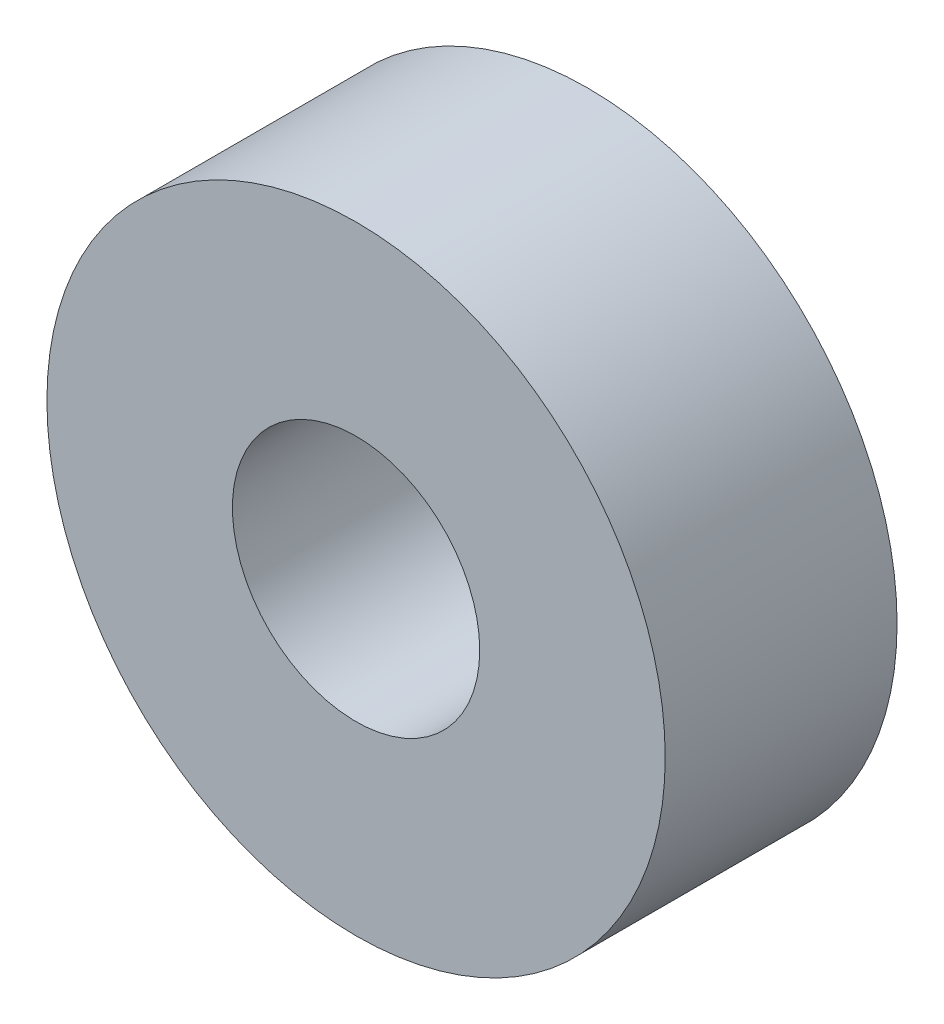
from build123d import *

# Parameters (mm, degrees)
EXTRUDE1_DEPTH      = 1.5
EXTRUDE1_DEPTH_BACK = 1.5
SKETCH1_R           = 4
SKETCH1_R_2         = 1.6


with BuildPart() as part:
    # Sketch1 → Extrude1 (new, two sides: drawn at the far end of the back side and taken through both)
    with BuildSketch(Plane.XY.offset(-EXTRUDE1_DEPTH_BACK)):
        Circle(SKETCH1_R)
        Circle(SKETCH1_R_2, mode=Mode.SUBTRACT)
    extrude(amount=EXTRUDE1_DEPTH + EXTRUDE1_DEPTH_BACK)


solid = part.part
